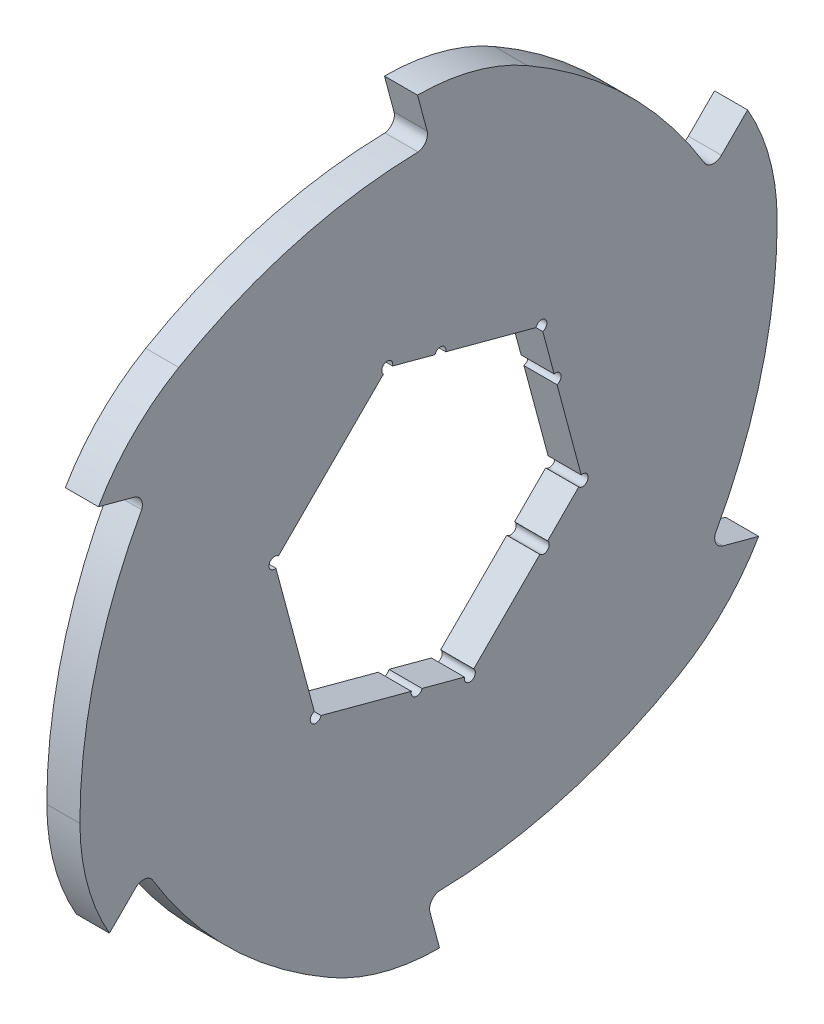
from build123d import *

# Parameters (mm, degrees)
SKETCH1_R                = 59
EXTRUDE1_DEPTH           = 3
EXTRUDE2_DEPTH           = 3
CIRPATTERN1_COUNT        = 6
F_2_0_2_DIAMETER_HOLE1_D = 2
F_2_0_2_DIAMETER_HOLE3_D = 2
CIRPATTERN2_COUNT        = 4
CIRPATTERN2_ANGLE        = 180


with BuildPart() as part:
    # Sketch1 → Extrude1 (new, symmetric)
    with BuildSketch(Plane(origin=(0, 0, 0), x_dir=(0, 0, -1), z_dir=(1, 0, 0))):
        Circle(SKETCH1_R)
        Polygon((20.453239352, 20.453239352), (-7.486405193, 27.939644545), (-27.939644545, 7.486405193), (-20.453239352, -20.453239352), (7.486405193, -27.939644545), (27.939644545, -7.486405193), align=None, mode=Mode.SUBTRACT)
    extrude(amount=EXTRUDE1_DEPTH, both=True)

    # Sketch2 → Extrude2 (add, symmetric)
    with BuildSketch(Plane(origin=(0, 0, 0), x_dir=(0, 0, -1), z_dir=(1, 0, 0))):
        with BuildLine():
            Line((-2, 67.961805723), (-0.262709442, 61.478149092))
            ThreePointArc((-0.262709442, 61.478149092), (-0.58620663, 59.77173183), (-2.122608272, 58.961805723))
            ThreePointArc((-2.122608272, 58.961805723), (28.679663449, 51.560419941), (51.21368579, 29.294340542))
            ThreePointArc((51.21368579, 29.294340542), (36.791707484, 48.186627241), (17.927108603, 62.644803614))
            ThreePointArc((17.927108603, 62.644803614), (8.312130826, 66.609702921), (-2, 67.961805723))
        make_face()
    extrude2 = extrude(amount=EXTRUDE2_DEPTH, both=True)

    # CirPattern1: Extrude2 ×6 about axis
    cirpattern1_axis = Axis((0, 0, 0), (1, 0, 0))
    for i in range(1, CIRPATTERN1_COUNT):
        add(extrude2.rotate(cirpattern1_axis, i * 360 / CIRPATTERN1_COUNT))

    # Ø2.0 (2) Diameter Hole1 (through all)
    with Locations(Plane(origin=(3, 0, 0), x_dir=(0, 0, -1), z_dir=(1, 0, 0))):
        with Locations((-7.486405193, 27.939644545), (20.453239352, 20.453239352), (27.939644545, -7.486405193), (7.486405193, -27.939644545), (-20.453239352, -20.453239352), (-27.939644545, 7.486405193)):
            Hole(F_2_0_2_DIAMETER_HOLE1_D / 2)

    # Ø2.0 (2) Diameter Hole3 (through all)
    with Locations(Plane(origin=(3, 0, 0), x_dir=(0, 0, -1), z_dir=(1, 0, 0))):
        with Locations((2.148784931, 25.357903132)):
            f_2_0_2_diameter_hole3 = Hole(F_2_0_2_DIAMETER_HOLE3_D / 2)

    # CirPattern2: Ø2.0 (2) Diameter Hole3 ×4 about axis
    cirpattern2_axis = Axis((0, 0, 0), (-1, 0, 0))
    for i in range(1, CIRPATTERN2_COUNT):
        add(f_2_0_2_diameter_hole3.rotate(cirpattern2_axis, i * CIRPATTERN2_ANGLE / (CIRPATTERN2_COUNT - 1)), mode=Mode.SUBTRACT)


solid = part.part
